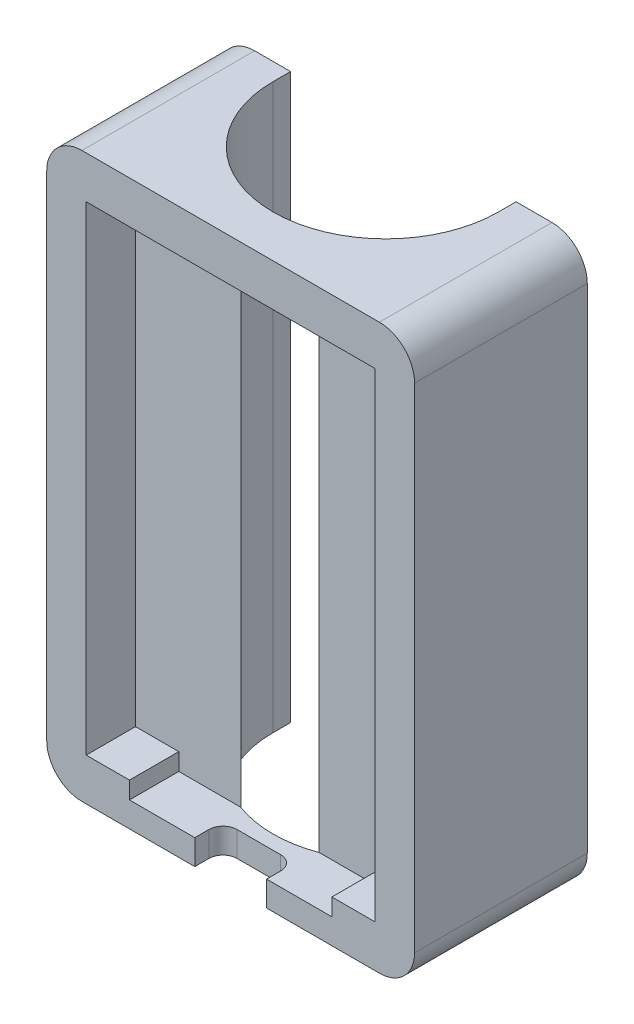
from build123d import *

# Parameters (mm, degrees)
ESQUISSE1_W             = 52.2
ESQUISSE1_H             = 80
BOSS_EXTRU_2_DEPTH      = 22
ESQUISSE3_W             = 48.72
ESQUISSE3_H             = 72.8776
ENL_V_MAT_EXTRU_1_DEPTH = 5
CONG_1_R                = 10
BOSS_EXTRU_4_DEPTH      = 5
ESQUISSE2_R             = 16
ENL_V_MAT_EXTRU_3_DEPTH = 93.647092521
ENL_V_MAT_EXTRU_5_DEPTH = 2
ESQUISSE8_W             = 10.19
ESQUISSE8_H             = 3.5612
ENL_V_MAT_EXTRU_6_DEPTH = 4
CONG_3_R                = 2
ESQUISSE9_W             = 10.1
ESQUISSE9_H             = 80
BOSS_EXTRU_5_DEPTH      = 2.5
CONG_4_R                = 5


with BuildPart() as part:
    # Esquisse1 → Boss.-Extru.2 (new body)
    with BuildSketch(Plane.XY):
        with Locations((-15.124795362, -42.006460905)):
            Rectangle(ESQUISSE1_W, ESQUISSE1_H)
    extrude(amount=BOSS_EXTRU_2_DEPTH)

    # Esquisse3 → Enlèv. mat.-Extru.1 (cut)
    with BuildSketch(Plane.XY.offset(22)):
        with Locations((-15.124795362, -42.006460905)):
            Rectangle(ESQUISSE3_W, ESQUISSE3_H)
    extrude(amount=-ENL_V_MAT_EXTRU_1_DEPTH, mode=Mode.SUBTRACT)

    # Congé1
    cong_1_edges = [part.edges().sort_by_distance(p)[0] for p in [
        (-39.484795362, -78.445260905, 19.5),
        (-39.484795362, -5.567660905, 19.5),
        (9.235204638, -5.567660905, 19.5),
        (9.235204638, -78.445260905, 19.5),
    ]]
    fillet(cong_1_edges, radius=CONG_1_R)

    # Esquisse5 → Boss.-Extru.4 (add)
    with BuildSketch(Plane.XY.offset(17)):
        with BuildLine():
            Line((-35.624795362, -68.445260905), (-35.624795362, -76.006460905))
            Line((-35.624795362, -76.006460905), (-29.484795362, -76.006460905))
            Line((-29.484795362, -76.006460905), (-29.484795362, -78.445260905))
            ThreePointArc((-29.484795362, -78.445260905), (-36.555863174, -75.516328717), (-39.484795362, -68.445260905))
            Line((-39.484795362, -68.445260905), (-39.484795362, -15.567660905))
            ThreePointArc((-39.484795362, -15.567660905), (-36.555863174, -8.496593093), (-29.484795362, -5.567660905))
            Line((-29.484795362, -5.567660905), (-0.764795362, -5.567660905))
            ThreePointArc((-0.764795362, -5.567660905), (6.30627245, -8.496593093), (9.235204638, -15.567660905))
            Line((9.235204638, -15.567660905), (9.235204638, -68.445260905))
            ThreePointArc((9.235204638, -68.445260905), (6.30627245, -75.516328717), (-0.764795362, -78.445260905))
            Line((-0.764795362, -78.445260905), (-0.764795362, -76.006460905))
            Line((-0.764795362, -76.006460905), (5.375204638, -76.006460905))
            Line((5.375204638, -76.006460905), (5.375204638, -68.445260905))
            Line((5.375204638, -68.445260905), (5.375204638, -15.567660905))
            Line((5.375204638, -15.567660905), (5.375204638, -8.006460905))
            Line((5.375204638, -8.006460905), (-35.624795362, -8.006460905))
            Line((-35.624795362, -8.006460905), (-35.624795362, -15.567660905))
            Line((-35.624795362, -15.567660905), (-35.624795362, -68.445260905))
        make_face()
    extrude(amount=BOSS_EXTRU_4_DEPTH)

    # Esquisse2 → Enlèv. mat.-Extru.3 (cut, through all)
    with BuildSketch(Plane.XZ.offset(82.006460905)):
        with Locations((-15.124795362, 0)):
            Circle(ESQUISSE2_R)
    extrude(amount=-ENL_V_MAT_EXTRU_3_DEPTH, mode=Mode.SUBTRACT)

    # Esquisse7 → Enlèv. mat.-Extru.5 (cut)
    with BuildSketch(Plane.XY.offset(17)):
        Polygon((-35.624795362, -8.006460905), (5.375204638, -8.006460905), (5.375204638, -76.006460905), (-0.764795362, -76.006460905), (-0.764795362, -78.445260905), (-29.484795362, -78.445260905), (-29.484795362, -76.006460905), (-35.624795362, -76.006460905), align=None)
    extrude(amount=-ENL_V_MAT_EXTRU_5_DEPTH, mode=Mode.SUBTRACT)

    # Esquisse8 → Enlèv. mat.-Extru.6 (cut)
    with BuildSketch(Plane.XY.offset(22)):
        with Locations((-15.124795362, -80.225860905)):
            Rectangle(ESQUISSE8_W, ESQUISSE8_H)
    extrude(amount=-ENL_V_MAT_EXTRU_6_DEPTH, mode=Mode.SUBTRACT)

    # Congé3
    cong_3_edges = [part.edges().sort_by_distance(p)[0] for p in [
        (-20.219795362, -80.225860905, 18),
        (-10.029795362, -80.225860905, 18),
    ]]
    fillet(cong_3_edges, radius=CONG_3_R)

    # Esquisse9 → Boss.-Extru.5 (add)
    with BuildSketch(Plane(origin=(0, 0, 0), x_dir=(-1, 0, 0), z_dir=(0, 0, -1))):
        with Locations((36.174795362, -42.006460905)):
            Rectangle(ESQUISSE9_W, ESQUISSE9_H)
        with Locations((-5.925204638, -42.006460905)):
            Rectangle(ESQUISSE9_W, ESQUISSE9_H)
    extrude(amount=BOSS_EXTRU_5_DEPTH)

    # Congé4
    cong_4_edges = [part.edges().sort_by_distance(p)[0] for p in [
        (-41.224795362, -2.006460905, 9.75),
        (10.975204638, -2.006460905, 9.75),
        (10.975204638, -82.006460905, 9.75),
        (-41.224795362, -82.006460905, 9.75),
    ]]
    fillet(cong_4_edges, radius=CONG_4_R)


solid = part.part
